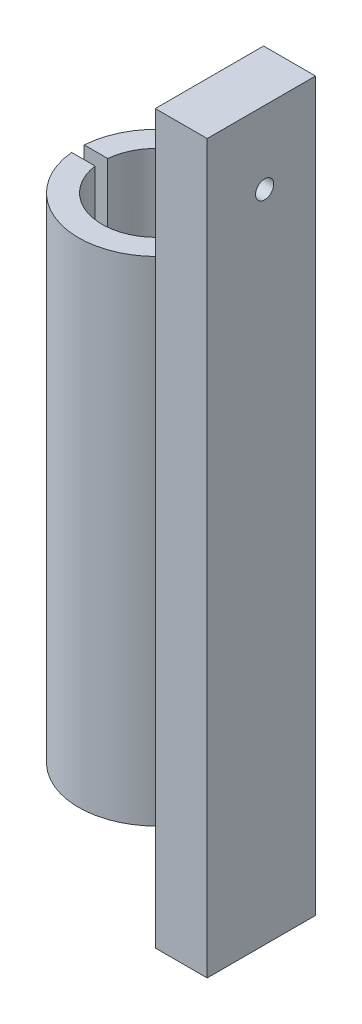
from build123d import *

# Parameters (mm, degrees)
SKETCH_1_R           = 15
EXTRUDE_1_DEPTH      = 95
SKETCH_2_R           = 10.5
CUT_EXTRUDE_1_DEPTH  = 95
EXTRUDE_2_DEPTH      = 20
EXTRUDE_2_DEPTH_BACK = 120
SKETCH_3_W           = 10
SKETCH_3_H           = 20.861334049
SKETCH_7_W           = 15
SKETCH_7_H           = 40
CUT_EXTRUDE_3_DEPTH  = 125.54811794
SKETCH_8_W           = 8.046060948
SKETCH_8_H           = 2.469161561
CUT_EXTRUDE_4_DEPTH  = 118.826105551
SKETCH_10_R          = 1.75
CUT_EXTRUDE_5_DEPTH  = 124.649640842


with BuildPart() as part:
    # 草图1 → 凸台-拉伸1 (new body)
    with BuildSketch(Plane(origin=(0, 0, 0), x_dir=(1, 0, 0), z_dir=(0, 1, 0))):
        with Locations(Location((0, 0, 0), (0, 0, 270))):
            Circle(SKETCH_1_R)
    extrude(amount=EXTRUDE_1_DEPTH)

    # 草图2 → 切除-拉伸1 (cut)
    with BuildSketch(Plane(origin=(0, 95, 0), x_dir=(1, 0, 0), z_dir=(0, 1, 0))):
        with Locations(Location((0, 0, 0), (0, 0, 270))):
            Circle(SKETCH_2_R)
    extrude(amount=-CUT_EXTRUDE_1_DEPTH, mode=Mode.SUBTRACT)

    # 草图3 → 凸台-拉伸2 (add, two sides: drawn at the far end of the back side and taken through both)
    with BuildSketch(Plane(origin=(0, 0, 0), x_dir=(-1, 0, 0), z_dir=(0, -1, 0)).offset(-EXTRUDE_2_DEPTH_BACK)):
        with Locations((-15.808439379, -0.631614786)):
            Rectangle(SKETCH_3_W, SKETCH_3_H)
    extrude(amount=EXTRUDE_2_DEPTH + EXTRUDE_2_DEPTH_BACK)

    # 草图7 → 切除-拉伸3 (cut, through all)
    with BuildSketch(Plane.XY.offset(11.06228181)):
        with Locations((-7.5, 55)):
            Rectangle(SKETCH_7_W, SKETCH_7_H)
    extrude(amount=-CUT_EXTRUDE_3_DEPTH, mode=Mode.SUBTRACT)

    # 草图8 → 切除-拉伸4 (cut, through all)
    with BuildSketch(Plane(origin=(0, 95, 0), x_dir=(1, 0, 0), z_dir=(0, 1, 0))):
        with Locations((-13.909114393, -0.200189033)):
            Rectangle(SKETCH_8_W, SKETCH_8_H)
    extrude(amount=-CUT_EXTRUDE_4_DEPTH, mode=Mode.SUBTRACT)

    # 草图10 → 切除-拉伸5 (cut, through all)
    with BuildSketch(Plane.ZY.offset(-10.808439379)):
        with Locations((0, 106)):
            Circle(SKETCH_10_R)
    extrude(amount=-CUT_EXTRUDE_5_DEPTH, mode=Mode.SUBTRACT)


solid = part.part
